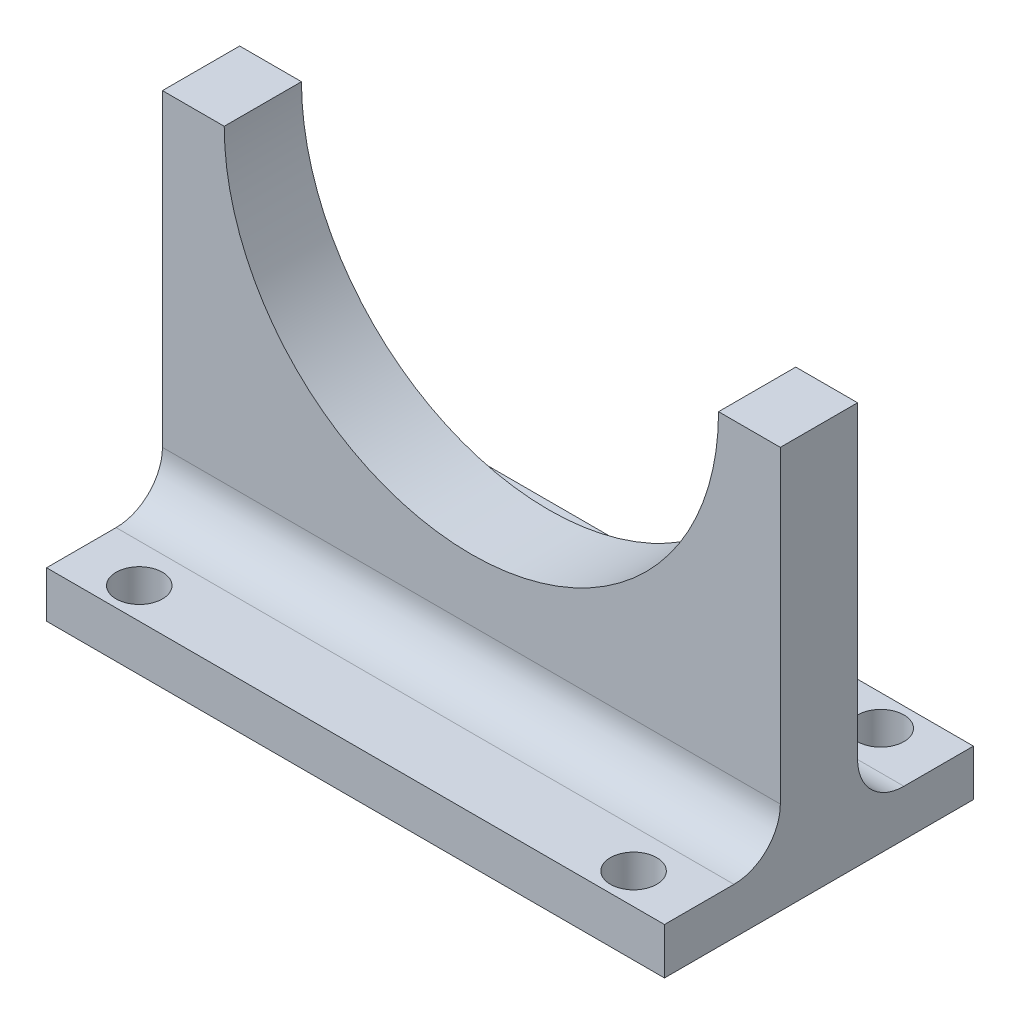
from build123d import *

# Parameters (mm, degrees)
BOSS_EXTRUDE1_DEPTH      = 2.5
BOSS_EXTRUDE1_DEPTH_BACK = 2.5
SKETCH1_W                = 40
SKETCH1_H                = 26
SKETCH2_R                = 16
CUT_EXTRUDE1_DEPTH       = 25.372115214
BOSS_EXTRUDE2_DEPTH      = 10
BOSS_EXTRUDE2_DEPTH_BACK = 10
SKETCH3_W                = 40
SKETCH3_H                = 3
FILLET1_R                = 3
SKETCH4_R                = 1.5
CUT_EXTRUDE2_DEPTH       = 33.078029865
MIRROR2_COPY_1_SKETCH_R  = 1.5
MIRROR2_COPY_1_DEPTH     = 33.078029865


with BuildPart() as part:
    # Sketch1 → Boss-Extrude1 (new, two sides: drawn at the far end of the back side and taken through both)
    with BuildSketch(Plane.XY.offset(-BOSS_EXTRUDE1_DEPTH_BACK)):
        Rectangle(SKETCH1_W, SKETCH1_H)
    extrude(amount=BOSS_EXTRUDE1_DEPTH + BOSS_EXTRUDE1_DEPTH_BACK)

    # Sketch2 → Cut-Extrude1 (cut, through all)
    with BuildSketch(Plane(origin=(0, 0, -2.5), x_dir=(-1, 0, 0), z_dir=(0, 0, -1))):
        with Locations((0, 13)):
            Circle(SKETCH2_R)
    extrude(amount=-CUT_EXTRUDE1_DEPTH, mode=Mode.SUBTRACT)

    # Sketch3 → Boss-Extrude2 (add, two sides: drawn at the far end of the back side and taken through both)
    with BuildSketch(Plane.XY.offset(-BOSS_EXTRUDE2_DEPTH_BACK)):
        with Locations((0, -11.5)):
            Rectangle(SKETCH3_W, SKETCH3_H)
    extrude(amount=BOSS_EXTRUDE2_DEPTH + BOSS_EXTRUDE2_DEPTH_BACK)

    # Fillet1
    fillet1_edges = [part.edges().sort_by_distance(p)[0] for p in [
        (0, -10, -2.5),
        (0, -10, 2.5),
    ]]
    fillet(fillet1_edges, radius=FILLET1_R)

    # Sketch4 → Cut-Extrude2 (cut, through all)
    with BuildSketch(Plane(origin=(0, -10, 0), x_dir=(1, 0, 0), z_dir=(0, 1, 0))):
        with Locations((16, 8)):
            Circle(SKETCH4_R)
    cut_extrude2 = extrude(amount=-CUT_EXTRUDE2_DEPTH, mode=Mode.SUBTRACT)

    # Mirror1: Cut-Extrude2 across plane
    add(cut_extrude2.mirror(Plane.XY), mode=Mode.SUBTRACT)

    # Mirror2: Cut-Extrude2 across plane
    add(cut_extrude2.mirror(Plane(origin=(0, 0, 0), x_dir=(0, 0, 1), z_dir=(1, 0, 0))), mode=Mode.SUBTRACT)

    # Mirror2 copy 1 sketch → Mirror2 copy 1 (cut, through all)
    with BuildSketch(Plane(origin=(0, -10, 0), x_dir=(-1, 0, 0), z_dir=(0, 1, 0))):
        with Locations((16, 8)):
            Circle(MIRROR2_COPY_1_SKETCH_R)
    extrude(amount=-MIRROR2_COPY_1_DEPTH, mode=Mode.SUBTRACT)


solid = part.part
